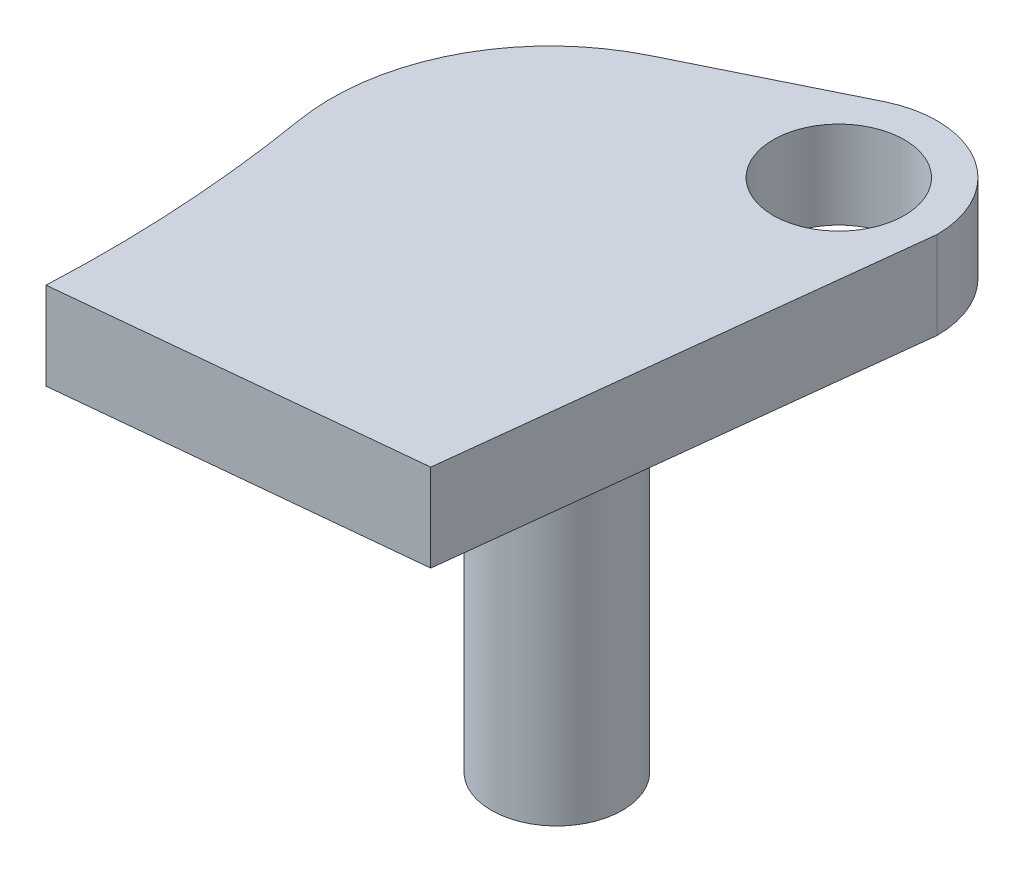
from build123d import *

# Parameters (mm, degrees)
SKETCH2_R           = 1.5
BOSS_EXTRUDE1_DEPTH = 2
SKETCH3_R           = 1.5
BOSS_EXTRUDE2_DEPTH = 7
FILLET1_R           = 5


with BuildPart() as part:
    # Sketch2 → Boss-Extrude1 (new body)
    with BuildSketch(Plane(origin=(0, 0, 0), x_dir=(1, 0, 0), z_dir=(0, 1, 0))):
        with BuildLine():
            Line((4.000381204, 4.673041052), (12.000381204, 5.468452872))
            Line((12.000381204, 5.468452872), (13.182938655, 15.86470146))
            ThreePointArc((13.182938655, 15.86470146), (12.140348497, 17.763296064), (9.978795124, 17.902374182))
            Line((9.978795124, 17.902374182), (2.798785178, 14.374278777))
            ThreePointArc((2.798785178, 14.374278777), (3.811303646, 9.574655641), (4.000381204, 4.673041052))
        make_face()
        with Locations(Location((10.932938655, 15.86470146, 0), (0, 0, 270))):
            Circle(SKETCH2_R, mode=Mode.SUBTRACT)
    extrude(amount=BOSS_EXTRUDE1_DEPTH)

    # Sketch3 → Boss-Extrude2 (add)
    with BuildSketch(Plane(origin=(0, 0, 0), x_dir=(1, 0, 0), z_dir=(0, 1, 0))):
        with Locations(Location((10.487550657, 9.86470146, 0), (0, 0, 270))):
            Circle(SKETCH3_R)
    extrude(amount=-BOSS_EXTRUDE2_DEPTH)

    # Fillet1
    fillet1_edges = [part.edges().sort_by_distance(p)[0] for p in [
        (2.798785178, 1, -14.374278777),
    ]]
    fillet(fillet1_edges, radius=FILLET1_R)


solid = part.part
